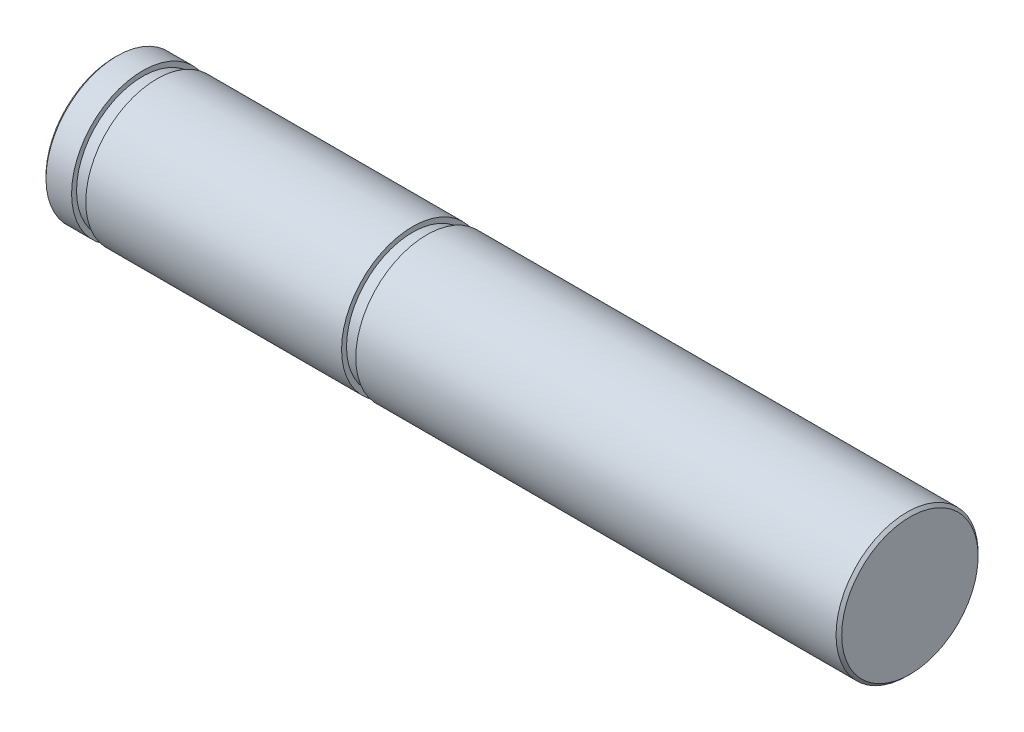
from build123d import *

# Parameters (mm, degrees)
CHAMFER2_SIZE = 0.2


with BuildPart() as part:
    # Sketch1 → Revolve1 (revolve)
    with BuildSketch(Plane.XY, mode=Mode.PRIVATE) as revolve1_sk:
        Polygon((0, 0), (0, 5), (-34, 5), (-34, 4.65), (-35, 4.65), (-35, 5), (-53, 5), (-53, 4.65), (-54, 4.65), (-54, 5), (-56, 5), (-56, 0), align=None)
    revolve(revolve1_sk.sketch.rotate(Axis((0, 0, 0), (1, 0, 0)), 90), axis=Axis((0, 0, 0), (1, 0, 0)))

    # Chamfer2
    chamfer2_edges = [part.edges().sort_by_distance(p)[0] for p in [
        (0, 0, -5),
        (-56, 0, -5),
    ]]
    chamfer(chamfer2_edges, length=CHAMFER2_SIZE)


solid = part.part
